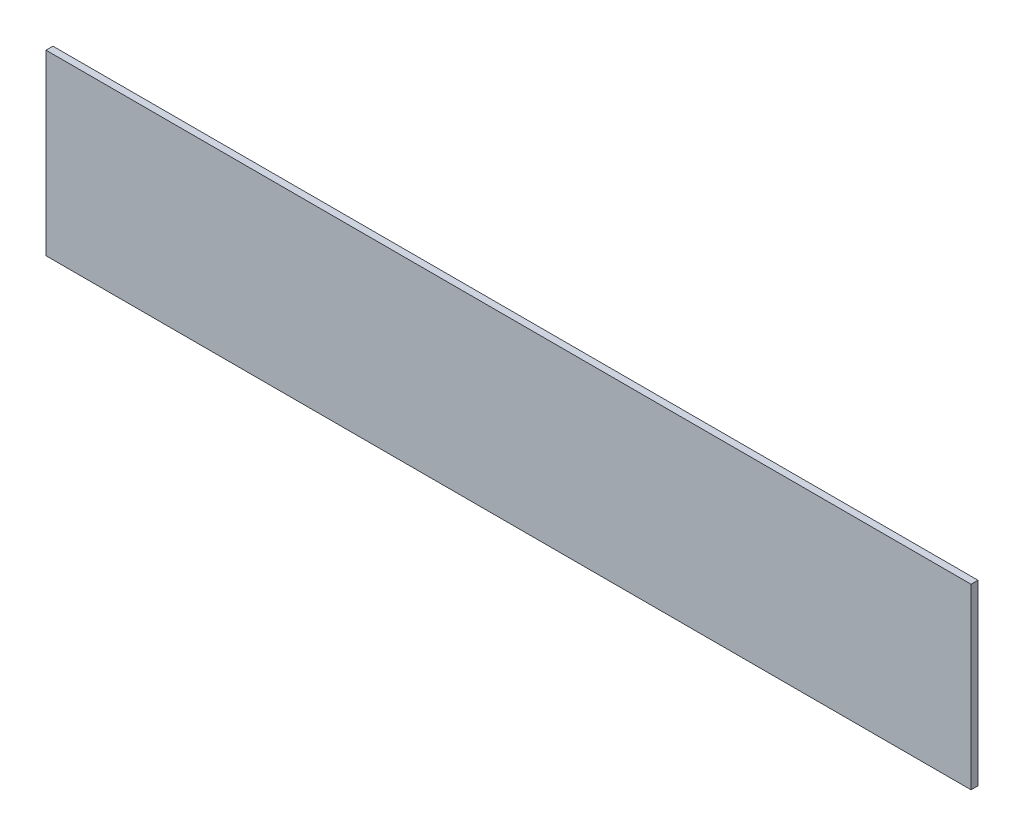
from build123d import *

# Parameters (mm, degrees)
SZKIC1_W                    = 400
SZKIC1_H                    = 77
DODANIE_WYCI_GNI_CIE1_DEPTH = 3


with BuildPart() as part:
    # Szkic1 → Dodanie-wyciągnięcie1 (new body)
    with BuildSketch(Plane.XY):
        with Locations((32.512137481, -107.46557971)):
            Rectangle(SZKIC1_W, SZKIC1_H)
    extrude(amount=DODANIE_WYCI_GNI_CIE1_DEPTH)


solid = part.part
